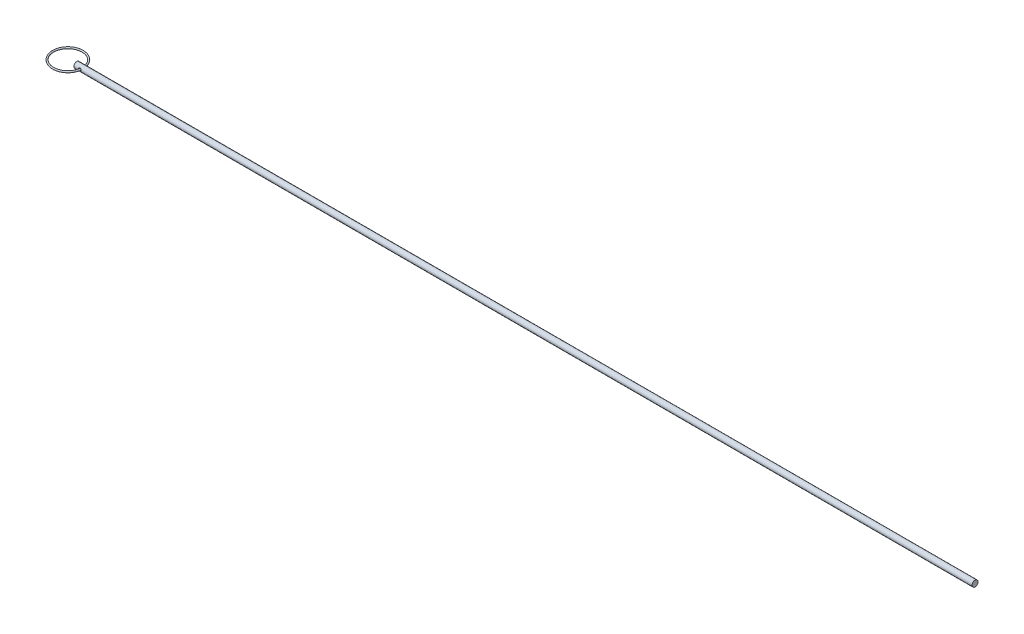
from build123d import *

# Parameters (mm, degrees)
SKETCH1_R               = 0.5
BOSS_EXTRUDE1_DEPTH     = 152.4
CUT_EXTRUDE1_DEPTH      = 153.401640411
CUT_EXTRUDE1_DEPTH_BACK = 153.401640411
SKETCH2_R               = 0.25
SKETCH7_R               = 0.127


with BuildPart() as part:
    # Sketch1 → Boss-Extrude1 (new body)
    with BuildSketch(Plane(origin=(0, 0, 0), x_dir=(0, 0, -1), z_dir=(1, 0, 0))):
        Circle(SKETCH1_R)
    extrude(amount=BOSS_EXTRUDE1_DEPTH)

    # Sketch2 → Cut-Extrude1 (cut, two sides: drawn at the far end of the back side and taken through both)
    with BuildSketch(Plane.XY.offset(-CUT_EXTRUDE1_DEPTH_BACK)):
        with Locations((1, 0)):
            Circle(SKETCH2_R)
    extrude(amount=CUT_EXTRUDE1_DEPTH + CUT_EXTRUDE1_DEPTH_BACK, mode=Mode.SUBTRACT)


with BuildPart() as body_2:
    # Sketch7 → Revolve7 (revolve)
    with BuildSketch(Plane.XY, mode=Mode.PRIVATE) as revolve7_sk:
        with Locations((1, 0)):
            Circle(SKETCH7_R)
    revolve(revolve7_sk.sketch.rotate(Axis((-1.5, 0.693957826, 0), (0, -1, 0)), 180), axis=Axis((-1.5, 0.693957826, 0), (0, -1, 0)))


solid = Compound([part.part, body_2.part])
